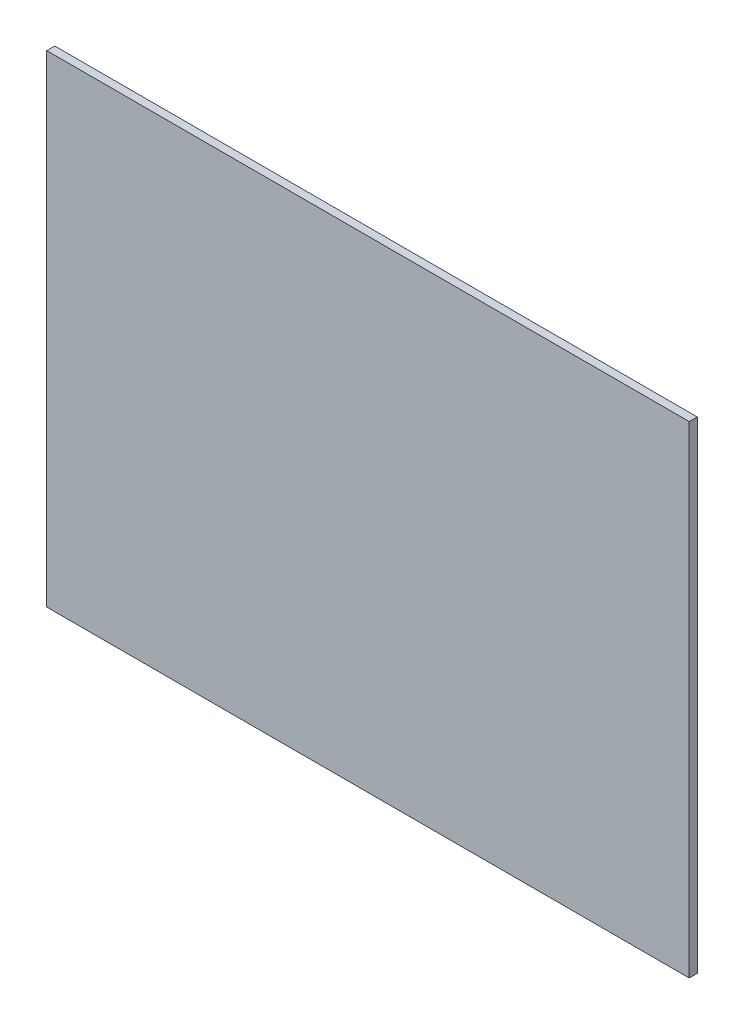
from build123d import *

# Parameters (mm, degrees)
SKETCH1_W           = 800
SKETCH1_H           = 600
BOSS_EXTRUDE1_DEPTH = 10


with BuildPart() as part:
    # Sketch1 → Boss-Extrude1 (new body)
    with BuildSketch(Plane.XY):
        with Locations((400, -300)):
            Rectangle(SKETCH1_W, SKETCH1_H)
    extrude(amount=BOSS_EXTRUDE1_DEPTH)


solid = part.part
